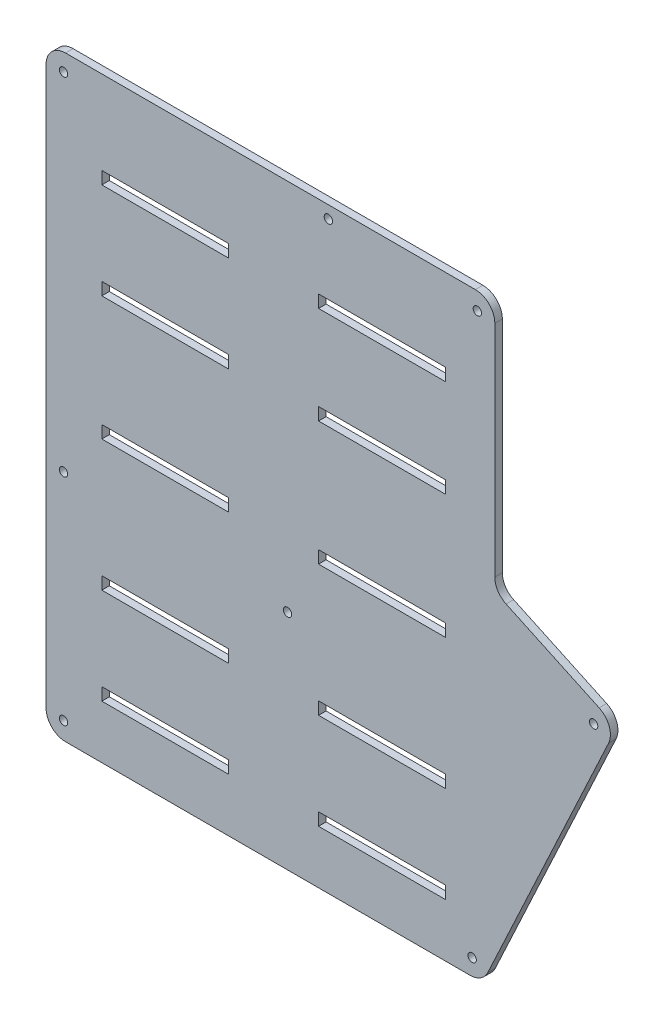
from build123d import *

# Parameters (mm, degrees)
SKETCH1_R           = 1.5
SKETCH1_W           = 45.562449769
SKETCH1_H           = 4.5
BOSS_EXTRUDE1_DEPTH = 2.7


with BuildPart() as part:
    # Sketch1 → Boss-Extrude1 (new body)
    with BuildSketch(Plane.XY):
        with BuildLine():
            Line((181.0868, 176.698), (181.0868, 97.809302293))
            ThreePointArc((181.0868, 97.809302293), (182.183121351, 94.048108544), (185.128679547, 91.465051085))
            Line((185.128679547, 91.465051085), (218.538914615, 75.886932175))
            ThreePointArc((218.538914615, 75.886932175), (222.158599458, 71.936940245), (221.924958355, 66.584373903))
            Line((221.924958355, 66.584373903), (178.566520277, -26.398891285))
            ThreePointArc((178.566520277, -26.398891285), (175.983463005, -29.344318185), (172.222356084, -30.44058422))
            Line((172.222356084, -30.44058422), (27, -30.44058422))
            ThreePointArc((27, -30.44058422), (22.050252532, -28.390331688), (20, -23.44058422))
            Line((20, -23.44058422), (20, 176.698))
            ThreePointArc((20, 176.698), (22.050252532, 181.647747468), (27, 183.698))
            Line((27, 183.698), (174.0868, 183.698))
            ThreePointArc((174.0868, 183.698), (179.036547468, 181.647747468), (181.0868, 176.698))
        make_face()
        with Locations(Location((216.558534729, 69.898485122, 0), (0, 0, 180))):
            Circle(SKETCH1_R, mode=Mode.SUBTRACT)
        with Locations(Location((106.66988, 49.713, 0), (0, 0, 180))):
            Circle(SKETCH1_R, mode=Mode.SUBTRACT)
        with Locations(Location((26.263876, 53.119376266, 0), (0, 0, 180))):
            Circle(SKETCH1_R, mode=Mode.SUBTRACT)
        with Locations(Location((26.263876266, 177.434123734, 0), (0, 0, 180))):
            Circle(SKETCH1_R, mode=Mode.SUBTRACT)
        with Locations(Location((121.3333, 179.253, 0), (0, 0, 180))):
            Circle(SKETCH1_R, mode=Mode.SUBTRACT)
        with Locations(Location((174.816573734, 177.434123734, 0), (0, 0, 180))):
            Circle(SKETCH1_R, mode=Mode.SUBTRACT)
        with Locations(Location((26.263876, -24.17668422, 0), (0, 0, 180))):
            Circle(SKETCH1_R, mode=Mode.SUBTRACT)
        with Locations(Location((172.941013343, -24.56864608, 0), (0, 0, 180))):
            Circle(SKETCH1_R, mode=Mode.SUBTRACT)
        with Locations((140.588022236, 151.948)):
            Rectangle(SKETCH1_W, SKETCH1_H, mode=Mode.SUBTRACT)
        with Locations((62.781224885, 151.448)):
            Rectangle(SKETCH1_W, SKETCH1_H, mode=Mode.SUBTRACT)
        with Locations((62.781224885, 116.948)):
            Rectangle(SKETCH1_W, SKETCH1_H, mode=Mode.SUBTRACT)
        with Locations((62.781224885, 72.448)):
            Rectangle(SKETCH1_W, SKETCH1_H, mode=Mode.SUBTRACT)
        with Locations((62.781224885, 25.448)):
            Rectangle(SKETCH1_W, SKETCH1_H, mode=Mode.SUBTRACT)
        with Locations((62.781224885, -9.052)):
            Rectangle(SKETCH1_W, SKETCH1_H, mode=Mode.SUBTRACT)
        with Locations((140.588022236, 116.948)):
            Rectangle(SKETCH1_W, SKETCH1_H, mode=Mode.SUBTRACT)
        with Locations((140.588022236, 72.448)):
            Rectangle(SKETCH1_W, SKETCH1_H, mode=Mode.SUBTRACT)
        with Locations((140.588022236, 25.448)):
            Rectangle(SKETCH1_W, SKETCH1_H, mode=Mode.SUBTRACT)
        with Locations((140.588022236, -9.052)):
            Rectangle(SKETCH1_W, SKETCH1_H, mode=Mode.SUBTRACT)
    extrude(amount=BOSS_EXTRUDE1_DEPTH)


solid = part.part
